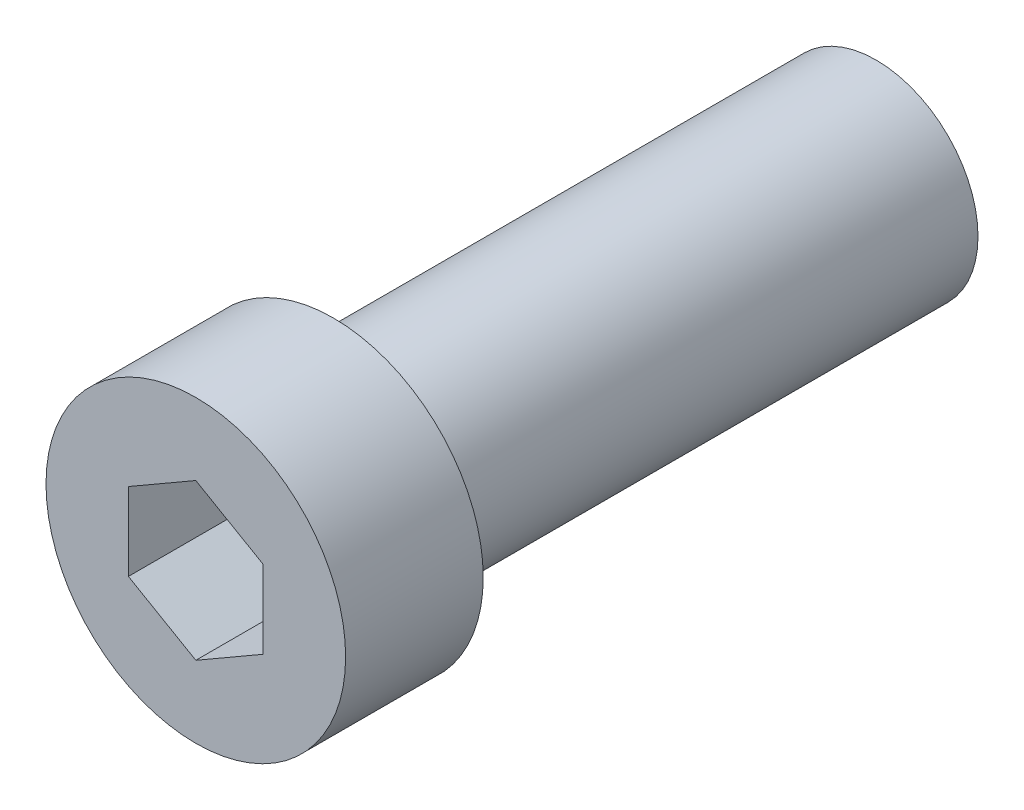
from build123d import *

# Parameters (mm, degrees)
SKETCH_1_W          = 2.208
SKETCH_1_H          = 2.028
SKETCH_2_R          = 1.5
EXTRUDE_1_DEPTH     = 8
CUT_EXTRUDE_1_DEPTH = 1.872


with BuildPart() as part:
    # 草图1 → 旋转1 (revolve)
    with BuildSketch(Plane.XZ, mode=Mode.PRIVATE) as revolve_1_sk:
        with Locations((1.104, 1.014)):
            Rectangle(SKETCH_1_W, SKETCH_1_H)
    revolve(revolve_1_sk.sketch.rotate(Axis((0, 0, 2.028), (0, 0, -1)), 270), axis=Axis((0, 0, 2.028), (0, 0, -1)))

    # 草图2 → 凸台-拉伸1 (add)
    with BuildSketch(Plane(origin=(0, 0, 0), x_dir=(-1, 0, 0), z_dir=(0, 0, -1))):
        with Locations(Location((0, 0, 0), (0, 0, 90))):
            Circle(SKETCH_2_R)
    extrude(amount=EXTRUDE_1_DEPTH)

    # 草图3 → 切除-拉伸1 (cut)
    with BuildSketch(Plane.XY.offset(2.028)):
        Polygon((0.9936, -0.573655227), (0.9936, 0.573655227), (0, 1.147310455), (-0.9936, 0.573655227), (-0.9936, -0.573655227), (0, -1.147310455), align=None)
    extrude(amount=-CUT_EXTRUDE_1_DEPTH, mode=Mode.SUBTRACT)


solid = part.part
